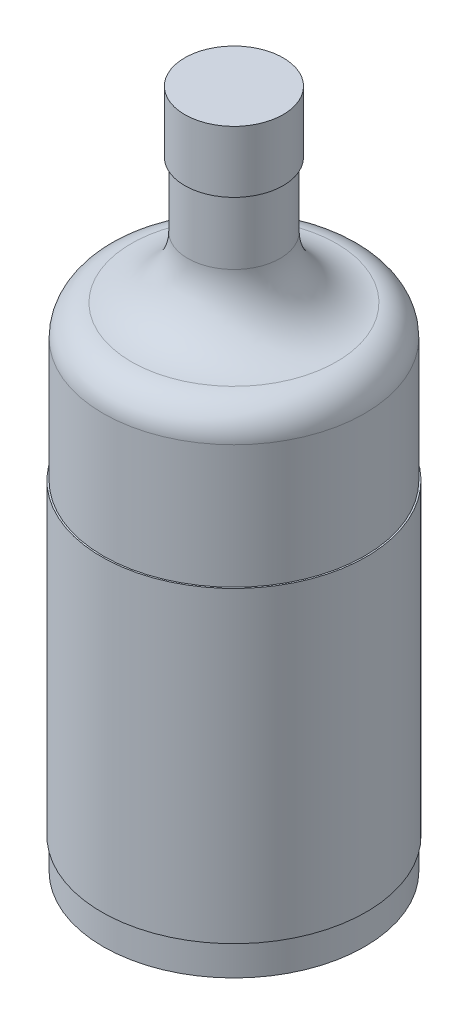
from build123d import *

# Parameters (mm, degrees)
SKETCH2_R           = 42.5
BOSS_EXTRUDE1_DEPTH = 160
SKETCH3_R           = 15
BOSS_EXTRUDE2_DEPTH = 60
FILLET1_R           = 20
FILLET2_R           = 10
BOSS_EXTRUDE3_START = 1
SKETCH4_R           = 16
BOSS_EXTRUDE3_DEPTH = 20
BOSS_EXTRUDE4_START = -10
SKETCH5_R           = 43
BOSS_EXTRUDE4_DEPTH = 100


with BuildPart() as part:
    # Sketch2 → Boss-Extrude1 (new body)
    with BuildSketch(Plane(origin=(0, 0, 0), x_dir=(1, 0, 0), z_dir=(0, 1, 0))):
        Circle(SKETCH2_R)
    extrude(amount=BOSS_EXTRUDE1_DEPTH)

    # Sketch3 → Boss-Extrude2 (add)
    with BuildSketch(Plane(origin=(0, 160, 0), x_dir=(1, 0, 0), z_dir=(0, 1, 0))):
        Circle(SKETCH3_R)
    extrude(amount=BOSS_EXTRUDE2_DEPTH)

    # Fillet1
    fillet1_edges = [part.edges().sort_by_distance(p)[0] for p in [
        (-15, 160, 0),
    ]]
    fillet(fillet1_edges, radius=FILLET1_R)

    # Fillet2
    fillet2_edges = [part.edges().sort_by_distance(p)[0] for p in [
        (-42.5, 160, 0),
    ]]
    fillet(fillet2_edges, radius=FILLET2_R)

    # Sketch4 → Boss-Extrude3 (add)
    with BuildSketch(Plane(origin=(0, 220, 0), x_dir=(1, 0, 0), z_dir=(0, 1, 0)).offset(BOSS_EXTRUDE3_START)):
        Circle(SKETCH4_R)
    extrude(amount=-BOSS_EXTRUDE3_DEPTH)

    # Sketch5 → Boss-Extrude4 (add)
    with BuildSketch(Plane.XZ.offset(BOSS_EXTRUDE4_START)):
        Circle(SKETCH5_R)
    extrude(amount=-BOSS_EXTRUDE4_DEPTH)


solid = part.part
